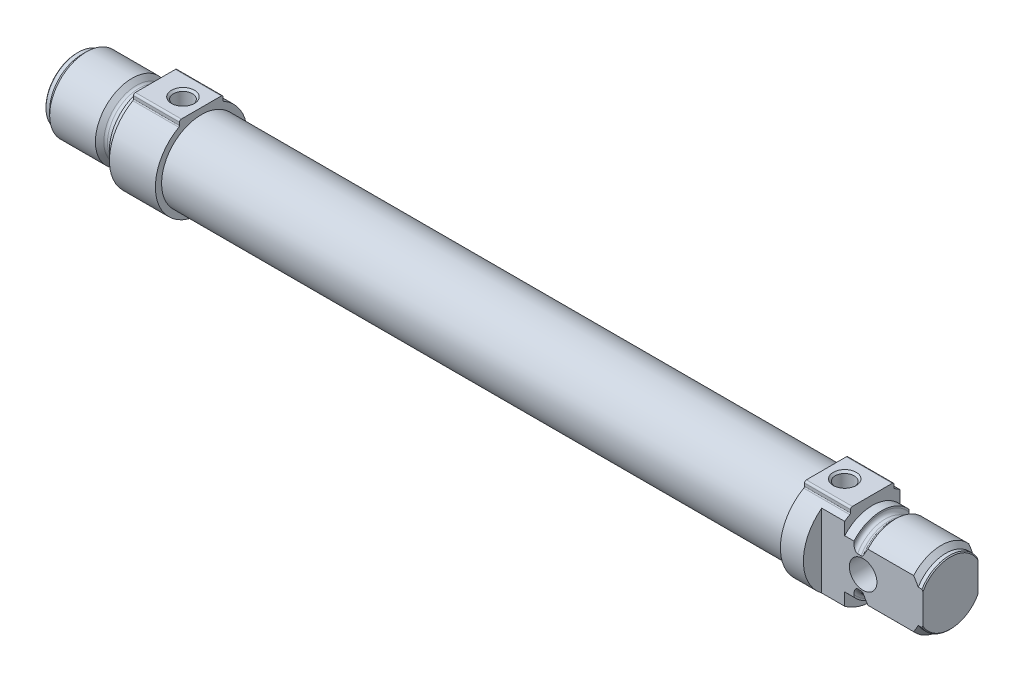
from build123d import *

# Parameters (mm, degrees)
AUFSATZ_LINEAR_AUSTRAGEN1_DEPTH      = 10
SKIZZE3_W                            = 136
SKIZZE3_H                            = 8.65
AUFSATZ_LINEAR_AUSTRAGEN2_DEPTH      = 10
SCHNITT_LINEAR_AUSTRAGEN1_DEPTH      = 10
SCHNITT_LINEAR_AUSTRAGEN1_DEPTH_BACK = 10
BOHRUNG1_D                           = 6
BOHRUNG2_D                           = 4.134
BOHRUNG2_DEPTH                       = 10
BOHRUNG2_CSINK_D                     = 5
BOHRUNG2_CSINK_ANGLE                 = 90
BOHRUNG3_D                           = 4.134
BOHRUNG3_DEPTH                       = 11
BOHRUNG3_CSINK_D                     = 5
BOHRUNG3_CSINK_ANGLE                 = 90
BOHRUNG3_TIP                         = 1.193383006


with BuildPart() as part:
    # Skizze1 → Rotation1 (revolve)
    with BuildSketch(Plane.XY):
        with BuildLine():
            Line((0, 0), (0, 6.8))
            Line((0, 6.8), (0.2, 7))
            Line((0.2, 7), (1, 7))
            Line((1, 7), (2, 8))
            Line((2, 8), (11.95, 8))
            Line((11.95, 8), (12.865685425, 7.084314575))
            ThreePointArc((12.865685425, 7.084314575), (13.125224104, 6.910896374), (13.43137085, 6.85))
            Line((13.43137085, 6.85), (14.2, 6.85))
            ThreePointArc((14.2, 6.85), (14.765685425, 7.084314575), (15, 7.65))
            Line((15, 7.65), (15, 8))
            Line((15, 8), (17, 8))
            Line((17, 8), (17, 0))
            Line((17, 0), (0, 0))
        make_face()
    revolve(axis=Axis((17, 0, 0), (-1, 0, 0)))

    # Skizze2 → Aufsatz-Linear austragen1 (add)
    with BuildSketch(Plane(origin=(17, 0, 0), x_dir=(0, 0, -1), z_dir=(1, 0, 0))):
        with BuildLine():
            Line((4.75, 8.977054082), (4.75, 9.6))
            ThreePointArc((4.75, 9.6), (4.632842712, 9.882842712), (4.35, 10))
            Line((4.35, 10), (-4.35, 10))
            ThreePointArc((-4.35, 10), (-4.632842712, 9.882842712), (-4.75, 9.6))
            Line((-4.75, 9.6), (-4.75, 8.977054082))
            ThreePointArc((-4.75, 8.977054082), (-4.791034545, 8.825604773), (-4.902912621, 8.715586488))
            ThreePointArc((-4.902912621, 8.715586488), (0, -10), (4.902912621, 8.715586488))
            ThreePointArc((4.902912621, 8.715586488), (4.791034545, 8.825604773), (4.75, 8.977054082))
        make_face()
    extrude(amount=AUFSATZ_LINEAR_AUSTRAGEN1_DEPTH)

    # Skizze3 → Rotation2 (revolve)
    with BuildSketch(Plane.XY):
        with Locations((95, 4.325)):
            Rectangle(SKIZZE3_W, SKIZZE3_H)
    revolve(axis=Axis((163, 0, 0), (-1, 0, 0)))

    # Skizze4 → Aufsatz-Linear austragen2 (add)
    with BuildSketch(Plane(origin=(163, 0, 0), x_dir=(0, 0, -1), z_dir=(1, 0, 0))):
        with BuildLine():
            Line((4.75, 8.977054082), (4.75, 9.6))
            ThreePointArc((4.75, 9.6), (4.632842712, 9.882842712), (4.35, 10))
            Line((4.35, 10), (-4.35, 10))
            ThreePointArc((-4.35, 10), (-4.632842712, 9.882842712), (-4.75, 9.6))
            Line((-4.75, 9.6), (-4.75, 8.977054082))
            ThreePointArc((-4.75, 8.977054082), (-4.791034545, 8.825604773), (-4.902912621, 8.715586488))
            ThreePointArc((-4.902912621, 8.715586488), (0, -10), (4.902912621, 8.715586488))
            ThreePointArc((4.902912621, 8.715586488), (4.791034545, 8.825604773), (4.75, 8.977054082))
        make_face()
    extrude(amount=AUFSATZ_LINEAR_AUSTRAGEN2_DEPTH)

    # Skizze5 → Rotation3 (revolve)
    with BuildSketch(Plane.XY):
        with BuildLine():
            Line((173, 0), (173, 8))
            Line((173, 8), (175, 8))
            Line((175, 8), (175, 7.65))
            ThreePointArc((175, 7.65), (175.234314575, 7.084314575), (175.8, 6.85))
            Line((175.8, 6.85), (176.56862915, 6.85))
            ThreePointArc((176.56862915, 6.85), (176.874775896, 6.910896374), (177.134314575, 7.084314575))
            Line((177.134314575, 7.084314575), (178.05, 8))
            Line((178.05, 8), (188, 8))
            Line((188, 8), (189, 7))
            Line((189, 7), (189.8, 7))
            Line((189.8, 7), (190, 6.8))
            Line((190, 6.8), (190, 0))
            Line((190, 0), (173, 0))
        make_face()
    revolve(axis=Axis((190, 0, 0), (-1, 0, 0)))

    # Skizze6 → Schnitt-Linear austragen1 (cut, two sides: drawn at the far end of the back side and taken through both)
    with BuildSketch(Plane(origin=(0, 0, 0), x_dir=(1, 0, 0), z_dir=(0, 1, 0)).offset(-SCHNITT_LINEAR_AUSTRAGEN1_DEPTH_BACK)):
        Polygon((168, 18), (168, 6), (190, 6), (190, -6), (168, -6), (168, -18), (202, -18), (202, 18), align=None)
    extrude(amount=SCHNITT_LINEAR_AUSTRAGEN1_DEPTH + SCHNITT_LINEAR_AUSTRAGEN1_DEPTH_BACK, mode=Mode.SUBTRACT)

    # Bohrung1 (through all)
    with Locations(Plane(origin=(0, 0, -6), x_dir=(-1, 0, 0), z_dir=(0, 0, -1))):
        with Locations((-177, 0)):
            Hole(BOHRUNG1_D / 2)

    # Bohrung2
    with Locations(Plane(origin=(0, 10, 0), x_dir=(1, 0, 0), z_dir=(0, 1, 0))):
        with Locations((23, 0)):
            CounterSinkHole(BOHRUNG2_D / 2, BOHRUNG2_CSINK_D / 2, depth=BOHRUNG2_DEPTH, counter_sink_angle=BOHRUNG2_CSINK_ANGLE)

    # Bohrung3
    with Locations(Plane(origin=(0, 10, 0), x_dir=(1, 0, 0), z_dir=(0, 1, 0))):
        with Locations((167, 0)):
            CounterSinkHole(BOHRUNG3_D / 2, BOHRUNG3_CSINK_D / 2, depth=BOHRUNG3_DEPTH, counter_sink_angle=BOHRUNG3_CSINK_ANGLE)
            with Locations((0, 0, -(BOHRUNG3_DEPTH + BOHRUNG3_TIP / 2))):  # 120° drill point
                Cone(0, BOHRUNG3_D / 2, BOHRUNG3_TIP, mode=Mode.SUBTRACT)

    # Skizze13 → Schnitt-Rotation1 (revolve, cut)
    with BuildSketch(Plane.XY):
        Polygon((-5, 0), (-5, 3), (41.2, 3), (41.2, 8), (145.2, 8), (145.2, 0), align=None)
    revolve(axis=Axis((145.2, 0, 0), (-1, 0, 0)), mode=Mode.SUBTRACT)


solid = part.part
